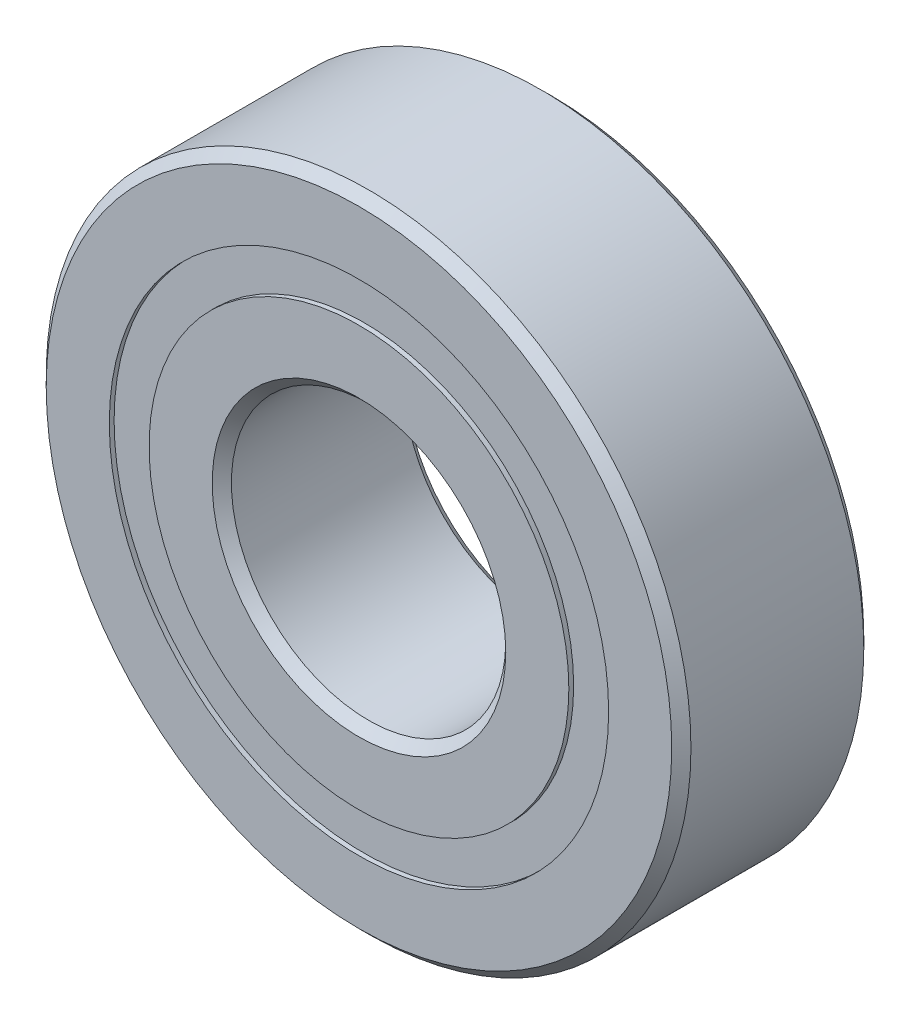
from build123d import *

# Parameters (mm, degrees)
CIRPATTERN1_COUNT = 12
SKETCH5_W         = 3.217347082
SKETCH5_H         = 2.901098902


with BuildPart() as part:
    # Sketch1 → Revolve1 (revolve)
    with BuildSketch(Plane(origin=(0, 0, 0), x_dir=(0, 0, -1), z_dir=(1, 0, 0))):
        with BuildLine():
            Line((6.3, 23.5), (-6.3, 23.5))
            Line((-6.3, 23.5), (-7, 22.8))
            Line((-7, 22.8), (-7, 18.200549451))
            Line((-7, 18.200549451), (-3.111111111, 18.200549451))
            ThreePointArc((-3.111111111, 18.200549451), (0, 20.182652918), (3.111111111, 18.200549451))
            Line((3.111111111, 18.200549451), (7, 18.200549451))
            Line((7, 18.200549451), (7, 22.8))
            Line((7, 22.8), (6.3, 23.5))
        make_face()
    revolve(axis=Axis((0, 0, 7), (0, 0, -1)))


with BuildPart() as body_2:
    # Sketch3 → Revolve3 (revolve)
    with BuildSketch(Plane(origin=(0, 0, 0), x_dir=(0, 0, -1), z_dir=(1, 0, 0))):
        with BuildLine():
            Line((-7, 15.299450549), (-3.111111111, 15.299450549))
            ThreePointArc((-3.111111111, 15.299450549), (0, 13.317347082), (3.111111111, 15.299450549))
            Line((3.111111111, 15.299450549), (7, 15.299450549))
            Line((7, 15.299450549), (7, 10.7))
            Line((7, 10.7), (6.3, 10))
            Line((6.3, 10), (-6.3, 10))
            Line((-6.3, 10), (-7, 10.7))
            Line((-7, 10.7), (-7, 15.299450549))
        make_face()
    revolve(axis=Axis((0, 0, 7), (0, 0, -1)))


with BuildPart() as body_3:
    # Sketch4 → Revolve4 (revolve)
    with BuildSketch(Plane(origin=(0, 0, 0), x_dir=(0, 0, -1), z_dir=(1, 0, 0))):
        with BuildLine():
            Line((-3.432652918, 16.75), (3.432652918, 16.75))
            ThreePointArc((3.432652918, 16.75), (0, 20.182652918), (-3.432652918, 16.75))
        make_face()
    revolve(axis=Axis((0, 16.75, 3.432652918), (0, 0, -1)))


with BuildPart() as cirpattern1_1:
    # CirPattern1: pattern copy
    add(body_3.part.rotate(Axis((0, 0, -7), (0, 0, 1)), 1 * 360 / CIRPATTERN1_COUNT))


with BuildPart() as cirpattern1_2:
    # CirPattern1: pattern copy
    add(body_3.part.rotate(Axis((0, 0, -7), (0, 0, 1)), 2 * 360 / CIRPATTERN1_COUNT))


with BuildPart() as cirpattern1_3:
    # CirPattern1: pattern copy
    add(body_3.part.rotate(Axis((0, 0, -7), (0, 0, 1)), 3 * 360 / CIRPATTERN1_COUNT))


with BuildPart() as cirpattern1_4:
    # CirPattern1: pattern copy
    add(body_3.part.rotate(Axis((0, 0, -7), (0, 0, 1)), 4 * 360 / CIRPATTERN1_COUNT))


with BuildPart() as cirpattern1_5:
    # CirPattern1: pattern copy
    add(body_3.part.rotate(Axis((0, 0, -7), (0, 0, 1)), 5 * 360 / CIRPATTERN1_COUNT))


with BuildPart() as cirpattern1_6:
    # CirPattern1: pattern copy
    add(body_3.part.rotate(Axis((0, 0, -7), (0, 0, 1)), 6 * 360 / CIRPATTERN1_COUNT))


with BuildPart() as cirpattern1_7:
    # CirPattern1: pattern copy
    add(body_3.part.rotate(Axis((0, 0, -7), (0, 0, 1)), 7 * 360 / CIRPATTERN1_COUNT))


with BuildPart() as cirpattern1_8:
    # CirPattern1: pattern copy
    add(body_3.part.rotate(Axis((0, 0, -7), (0, 0, 1)), 8 * 360 / CIRPATTERN1_COUNT))


with BuildPart() as cirpattern1_9:
    # CirPattern1: pattern copy
    add(body_3.part.rotate(Axis((0, 0, -7), (0, 0, 1)), 9 * 360 / CIRPATTERN1_COUNT))


with BuildPart() as cirpattern1_10:
    # CirPattern1: pattern copy
    add(body_3.part.rotate(Axis((0, 0, -7), (0, 0, 1)), 10 * 360 / CIRPATTERN1_COUNT))


with BuildPart() as cirpattern1_11:
    # CirPattern1: pattern copy
    add(body_3.part.rotate(Axis((0, 0, -7), (0, 0, 1)), 11 * 360 / CIRPATTERN1_COUNT))


with BuildPart() as body_15:
    # Sketch5 → Revolve5 (revolve)
    with BuildSketch(Plane(origin=(0, 0, 0), x_dir=(0, 0, -1), z_dir=(1, 0, 0))):
        with Locations((-5.041326459, 16.75)):
            Rectangle(SKETCH5_W, SKETCH5_H)
        with Locations((5.041326459, 16.75)):
            Rectangle(SKETCH5_W, SKETCH5_H)
    revolve(axis=Axis((0, 0, 7), (0, 0, -1)))


solid = Compound([part.part, body_2.part, body_3.part, cirpattern1_1.part, cirpattern1_2.part, cirpattern1_3.part, cirpattern1_4.part, cirpattern1_5.part, cirpattern1_6.part, cirpattern1_7.part, cirpattern1_8.part, cirpattern1_9.part, cirpattern1_10.part, cirpattern1_11.part, body_15.part])
